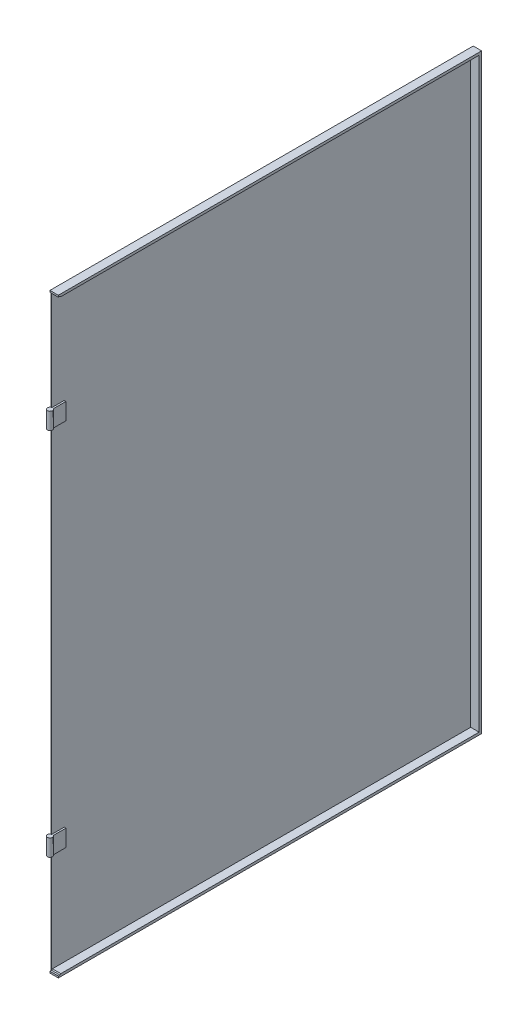
from build123d import *

# Parameters (mm, degrees)
CROQUIS1_W              = 500
CROQUIS1_H              = 700
SALIENTE_EXTRUIR1_DEPTH = 500
VACIADO1_T              = -1
CROQUIS2_W              = 15
CROQUIS2_H              = 20
SALIENTE_EXTRUIR2_DEPTH = 2
SALIENTE_EXTRUIR3_START = -20
CROQUIS3_R              = 3
SALIENTE_EXTRUIR3_DEPTH = 20
SALIENTE_EXTRUIR4_START = -20
SALIENTE_EXTRUIR4_DEPTH = 20
CORTAR_EXTRUIR1_DEPTH   = 792.853048236
CROQUIS6_R              = 797.844751534
CORTAR_EXTRUIR2_DEPTH   = 50
CROQUIS7_W              = 449
CROQUIS7_H              = 499
CORTAR_EXTRUIR3_DEPTH   = 50
CROQUIS8_W              = 449
CROQUIS8_H              = 699
CORTAR_EXTRUIR4_DEPTH   = 50
CROQUIS9_W              = 449
CROQUIS9_H              = 500
CORTAR_EXTRUIR5_DEPTH   = 50
SALIENTE_EXTRUIR5_DEPTH = 10


with BuildPart() as part:
    # Croquis1 → Saliente-Extruir1 (new body)
    with BuildSketch(Plane.XY):
        Rectangle(CROQUIS1_W, CROQUIS1_H)
    extrude(amount=SALIENTE_EXTRUIR1_DEPTH)

    # Vaciado1
    vaciado1_openings = [part.faces().sort_by_distance(p)[0] for p in [
        (0, 0, 500),
    ]]
    offset(amount=VACIADO1_T, openings=vaciado1_openings, kind=Kind.INTERSECTION)

    # Croquis2 → Saliente-Extruir2 (add)
    with BuildSketch(Plane(origin=(-249, 0, 0), x_dir=(0, 0, -1), z_dir=(1, 0, 0))):
        with Locations((-492.5, 220)):
            Rectangle(CROQUIS2_W, CROQUIS2_H)
        with Locations((-492.5, -220)):
            Rectangle(CROQUIS2_W, CROQUIS2_H)
    extrude(amount=SALIENTE_EXTRUIR2_DEPTH)

    # Croquis3 → Saliente-Extruir3 (add)
    with BuildSketch(Plane.XZ.offset(230).offset(SALIENTE_EXTRUIR3_START)):
        with Locations((-248.5, 502.5)):
            Circle(CROQUIS3_R)
    extrude(amount=SALIENTE_EXTRUIR3_DEPTH)

    # Croquis4 → Saliente-Extruir4 (add)
    with BuildSketch(Plane.XZ.offset(-210).offset(SALIENTE_EXTRUIR4_START)):
        with BuildLine():
            Line((-250, 499.901923789), (-247, 499.901923789))
            ThreePointArc((-247, 499.901923789), (-248.5, 505.5), (-250, 499.901923789))
        make_face()
    extrude(amount=SALIENTE_EXTRUIR4_DEPTH)

    # Croquis5 → Cortar-Extruir1 (cut, through all)
    with BuildSketch(Plane(origin=(-249, 0, 0), x_dir=(0, 0, -1), z_dir=(1, 0, 0))):
        Polygon((-485, -210), (-485, -230), (-500, -230), (-500, -349), (-1, -349), (-1, 349), (-500, 349), (-500, 230), (-485, 230), (-485, 210), (-500, 210), (-500, -210), align=None)
    extrude(amount=CORTAR_EXTRUIR1_DEPTH, mode=Mode.SUBTRACT)


with BuildPart() as cortar_extruir1_piece_1:
    # of the separate pieces the step leaves, piece 1, a body of its own (cortar_extruir1_pieces)
    add(part.part.solids().sort_by_distance((-250, -350, 0))[0])


with BuildPart() as cortar_extruir1_piece_2:
    # of the separate pieces the step leaves, piece 2, a body of its own (cortar_extruir1_pieces)
    add(part.part.solids().sort_by_distance((250, 210, 500))[0])


with BuildPart() as cortar_extruir1_piece_3:
    # of the separate pieces the step leaves, piece 3, a body of its own (cortar_extruir1_pieces)
    add(part.part.solids().sort_by_distance((250, -230, 485))[0])


with BuildPart() as cortar_extruir2_tool:
    # Croquis6 → Cortar-Extruir2 (new body)
    with BuildSketch(Plane(origin=(250, 0, 0), x_dir=(0, 0, -1), z_dir=(1, 0, 0))):
        with Locations((-1, 0)):
            Circle(CROQUIS6_R)
    extrude(amount=-CORTAR_EXTRUIR2_DEPTH)


with BuildPart() as cortar_extruir1_piece_1_1:
    add(cortar_extruir1_piece_1.part)

    # Cortar-Extruir2: cut by cortar_extruir2_tool
    add(cortar_extruir2_tool.part, mode=Mode.SUBTRACT)

    # Croquis7 → Cortar-Extruir3 (cut)
    with BuildSketch(Plane(origin=(0, -349, 0), x_dir=(1, 0, 0), z_dir=(0, 1, 0))):
        with Locations((-24.5, -250.5)):
            Rectangle(CROQUIS7_W, CROQUIS7_H)
    extrude(amount=-CORTAR_EXTRUIR3_DEPTH, mode=Mode.SUBTRACT)

    # Croquis8 → Cortar-Extruir4 (cut)
    with BuildSketch(Plane.XY.offset(1)):
        with Locations((-24.5, -0.5)):
            Rectangle(CROQUIS8_W, CROQUIS8_H)
    extrude(amount=-CORTAR_EXTRUIR4_DEPTH, mode=Mode.SUBTRACT)

    # Croquis9 → Cortar-Extruir5 (cut)
    with BuildSketch(Plane.XZ.offset(-349)):
        with Locations((-24.5, 250)):
            Rectangle(CROQUIS9_W, CROQUIS9_H)
    extrude(amount=-CORTAR_EXTRUIR5_DEPTH, mode=Mode.SUBTRACT)

    # Croquis10 → Saliente-Extruir5 (add)
    with BuildSketch(Plane(origin=(-249, 0, 0), x_dir=(0, 0, -1), z_dir=(1, 0, 0))):
        Polygon((2, -352), (2, 352), (-502, 352), (-502, 350), (-500, 350), (-499, 349), (-1, 349), (-1, -349), (-499, -349), (-500, -350), (-502, -350), (-502, -352), align=None)
    extrude(amount=SALIENTE_EXTRUIR5_DEPTH)


with BuildPart() as cortar_extruir1_piece_2_1:
    add(cortar_extruir1_piece_2.part)

    # Cortar-Extruir2: cut by cortar_extruir2_tool
    add(cortar_extruir2_tool.part, mode=Mode.SUBTRACT)


with BuildPart() as cortar_extruir1_piece_3_1:
    add(cortar_extruir1_piece_3.part)

    # Cortar-Extruir2: cut by cortar_extruir2_tool
    add(cortar_extruir2_tool.part, mode=Mode.SUBTRACT)


solid = cortar_extruir1_piece_1_1.part
